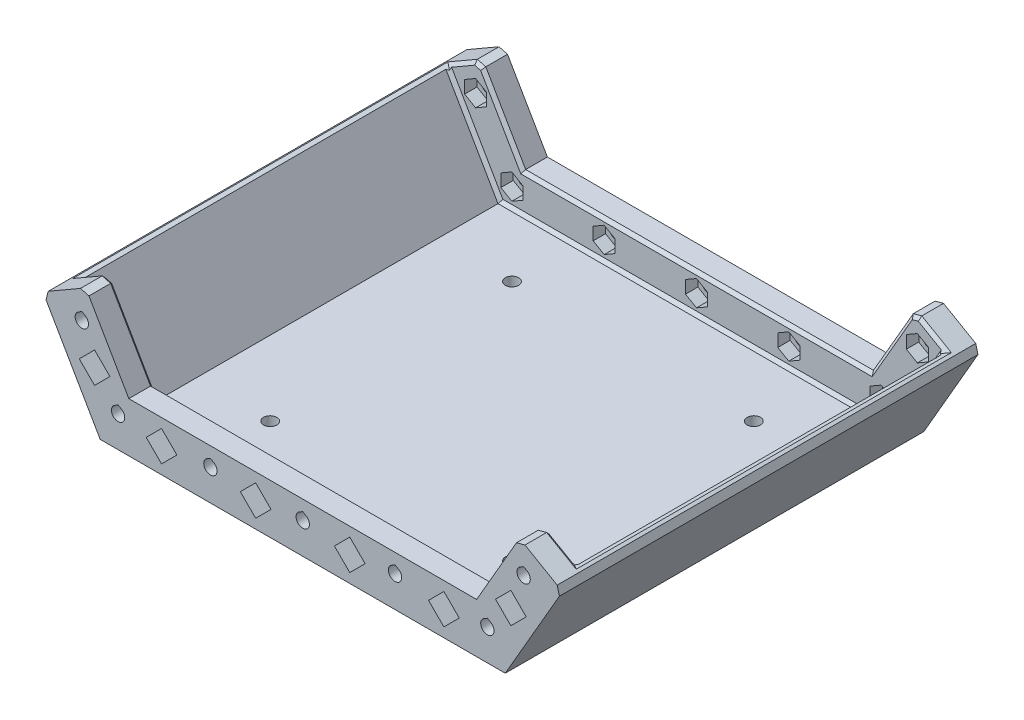
from build123d import *

# Parameters (mm, degrees)
BOSS_EXTRUDE1_DEPTH = 59.5
BOSS_EXTRUDE2_DEPTH = 8
SKETCH3_R           = 2.15
CUT_EXTRUDE1_DEPTH  = 159.997122203
CUT_EXTRUDE2_DEPTH  = 4
CUT_EXTRUDE3_DEPTH  = 5
CHAMFER1_SIZE       = 2
CHAMFER2_SIZE       = 1
SKETCH7_R           = 2.15
CUT_EXTRUDE4_DEPTH  = 113.417646184
CHAMFER3_SIZE       = 1
CUT_EXTRUDE6_DEPTH  = 171.814159757
CUT_EXTRUDE7_DEPTH  = 171.814159757


with BuildPart() as part:
    # Sketch1 → Boss-Extrude1 (new, symmetric)
    with BuildSketch(Plane.XY):
        Polygon((-83.803847577, -32), (-65.328638963, -64), (65.328638963, -64), (83.803847577, -32), (80.339745962, -30), (63.019237886, -60), (-63.019237886, -60), (-80.339745962, -30), align=None)
    extrude(amount=BOSS_EXTRUDE1_DEPTH, both=True)

    # Sketch2 → Boss-Extrude2 (add)
    with BuildSketch(Plane.XY.offset(59.5)):
        Polygon((-83.803847577, -32), (-69.947441117, -24), (-56.091034656, -48), (56.091034656, -48), (69.947441117, -24), (83.803847577, -32), (65.328638963, -64), (-65.328638963, -64), align=None)
    boss_extrude2 = extrude(amount=BOSS_EXTRUDE2_DEPTH)

    # Sketch3 → Cut-Extrude1 (cut, through all)
    with BuildSketch(Plane(origin=(0, 0, 59.5), x_dir=(-1, 0, 0), z_dir=(0, 0, -1))):
        with Locations((-71.246479222, -33.75)):
            Circle(SKETCH3_R)
        with Locations((-59.555136271, -54)):
            Circle(SKETCH3_R)
        with Locations((-29.777568136, -54)):
            Circle(SKETCH3_R)
        with Locations((0, -54)):
            Circle(SKETCH3_R)
        with Locations((29.777568136, -54)):
            Circle(SKETCH3_R)
        with Locations((59.555136271, -54)):
            Circle(SKETCH3_R)
        with Locations((71.246479222, -33.75)):
            Circle(SKETCH3_R)
    cut_extrude1 = extrude(amount=-CUT_EXTRUDE1_DEPTH, mode=Mode.SUBTRACT)

    # Sketch4 → Cut-Extrude2 (cut)
    with BuildSketch(Plane(origin=(0, 0, 59.5), x_dir=(-1, 0, 0), z_dir=(0, 0, -1))):
        Polygon((-67.696479222, -35.799593456), (-67.696479222, -31.700406544), (-71.246479222, -29.650813089), (-74.796479222, -31.700406544), (-74.796479222, -35.799593456), (-71.246479222, -37.849186911), align=None)
        Polygon((-56.005136271, -51.950406544), (-59.555136271, -49.900813089), (-63.105136271, -51.950406544), (-63.105136271, -56.049593456), (-59.555136271, -58.099186911), (-56.005136271, -56.049593456), align=None)
        Polygon((-3.55, -56.049593456), (0, -58.099186911), (3.55, -56.049593456), (3.55, -51.950406544), (0, -49.900813089), (-3.55, -51.950406544), align=None)
        Polygon((56.005136271, -56.049593456), (59.555136271, -58.099186911), (63.105136271, -56.049593456), (63.105136271, -51.950406544), (59.555136271, -49.900813089), (56.005136271, -51.950406544), align=None)
        Polygon((67.696479222, -31.700406544), (67.696479222, -35.799593456), (71.246479222, -37.849186911), (74.796479222, -35.799593456), (74.796479222, -31.700406544), (71.246479222, -29.650813089), align=None)
        Polygon((-26.227568136, -51.950406544), (-29.777568136, -49.900813089), (-33.327568136, -51.950406544), (-33.327568136, -56.049593456), (-29.777568136, -58.099186911), (-26.227568136, -56.049593456), align=None)
        Polygon((33.327568136, -51.950406544), (29.777568136, -49.900813089), (26.227568136, -51.950406544), (26.227568136, -56.049593456), (29.777568136, -58.099186911), (33.327568136, -56.049593456), align=None)
    cut_extrude2 = extrude(amount=-CUT_EXTRUDE2_DEPTH, mode=Mode.SUBTRACT)

    # Sketch6 → Cut-Extrude3 (cut)
    with BuildSketch(Plane.XY.offset(67.5)):
        Polygon((-67.132858554, -49.824747468), (-72.082606023, -44.875), (-67.132858554, -39.925252532), (-62.183111086, -44.875), align=None)
        Polygon((62.183111086, -44.875), (67.132858554, -39.925252532), (72.082606023, -44.875), (67.132858554, -49.824747468), align=None)
        Polygon((50.482125076, -56), (45.532377607, -51.050252532), (40.582630139, -56), (45.532377607, -60.949747468), align=None)
        Polygon((-40.582630139, -56), (-45.532377607, -51.050252532), (-50.482125076, -56), (-45.532377607, -60.949747468), align=None)
        Polygon((-10.227711734, -56), (-15.177459202, -51.050252532), (-20.127206671, -56), (-15.177459202, -60.949747468), align=None)
        Polygon((20.127206671, -56), (15.177459202, -51.050252532), (10.227711734, -56), (15.177459202, -60.949747468), align=None)
    cut_extrude3 = extrude(amount=-CUT_EXTRUDE3_DEPTH, mode=Mode.SUBTRACT)

    # Mirror1: Boss-Extrude2, Cut-Extrude1, Cut-Extrude2, Cut-Extrude3 across plane
    add(boss_extrude2.mirror(Plane.XY))
    add(cut_extrude1.mirror(Plane.XY), mode=Mode.SUBTRACT)
    add(cut_extrude2.mirror(Plane.XY), mode=Mode.SUBTRACT)
    add(cut_extrude3.mirror(Plane.XY), mode=Mode.SUBTRACT)

    # Chamfer1
    chamfer1_edges = [part.edges().sort_by_distance(p)[0] for p in [
        (83.803847577, -32, 0),
        (-83.803847577, -32, 0),
        (69.947441117, -24, 63.5),
        (-69.947441117, -24, 63.5),
        (-69.947441117, -24, -63.5),
        (69.947441117, -24, -63.5),
    ]]
    chamfer(chamfer1_edges, length=CHAMFER1_SIZE)

    # Chamfer2
    chamfer2_edges = [part.edges().sort_by_distance(p)[0] for p in [
        (-80.339745962, -30, 0),
        (80.339745962, -30, 0),
        (76.009618943, -27.5, 59.5),
        (0, -48, 59.5),
        (-62.519237886, -36.866025404, 59.5),
        (76.009618943, -27.5, -59.5),
        (0, -48, -59.5),
        (-62.519237886, -36.866025404, -59.5),
        (62.519237886, -36.866025404, -59.5),
        (-76.009618943, -27.5, -59.5),
        (70.313466521, -25.366025404, -59.5),
        (-70.313466521, -25.366025404, -59.5),
        (-76.009618943, -27.5, 59.5),
        (62.519237886, -36.866025404, 59.5),
        (70.313466521, -25.366025404, 59.5),
        (-70.313466521, -25.366025404, 59.5),
    ]]
    chamfer(chamfer2_edges, length=CHAMFER2_SIZE)

    # Sketch7 → Cut-Extrude4 (cut, through all)
    with BuildSketch(Plane(origin=(0, -60, 0), x_dir=(1, 0, 0), z_dir=(0, 1, 0))):
        with Locations(Location((-39, 39, 0), (0, 0, 180))):
            Circle(SKETCH7_R)
        with Locations(Location((39, 39, 0), (0, 0, 180))):
            Circle(SKETCH7_R)
        with Locations(Location((39, -39, 0), (0, 0, 180))):
            Circle(SKETCH7_R)
        with Locations(Location((-39, -39, 0), (0, 0, 180))):
            Circle(SKETCH7_R)
    extrude(amount=-CUT_EXTRUDE4_DEPTH, mode=Mode.SUBTRACT)

    # Chamfer3
    chamfer3_edges = [part.edges().sort_by_distance(p)[0] for p in [
        (0, -60, 59.5),
        (-71.429491924, -45.433012702, 59.5),
        (71.429491924, -45.433012702, 59.5),
        (71.429491924, -45.433012702, -59.5),
        (-71.429491924, -45.433012702, -59.5),
        (0, -60, -59.5),
    ]]
    chamfer(chamfer3_edges, length=CHAMFER3_SIZE)

    # Sketch9 → Cut-Extrude6 (cut, through all)
    with BuildSketch(Plane(origin=(0, 0, -67.5), x_dir=(-1, 0, 0), z_dir=(0, 0, -1))):
        Polygon((-72.321479222, -31.888045382), (-71.246479222, -31.267393842), (-70.171479222, -31.888045382), align=None)
        Polygon((-60.630136271, -52.138045382), (-58.480136271, -52.138045382), (-59.555136271, -51.517393842), align=None)
        Polygon((-28.702568136, -52.138045382), (-30.852568136, -52.138045382), (-29.777568136, -51.517393842), align=None)
    cut_extrude6 = extrude(amount=-CUT_EXTRUDE6_DEPTH, mode=Mode.SUBTRACT)

    # Mirror2: Cut-Extrude6 across plane
    add(cut_extrude6.mirror(Plane(origin=(0, 0, 0), x_dir=(0, 0, 1), z_dir=(1, 0, 0))), mode=Mode.SUBTRACT)

    # Sketch10 → Cut-Extrude7 (cut, through all)
    with BuildSketch(Plane(origin=(0, 0, -67.5), x_dir=(-1, 0, 0), z_dir=(0, 0, -1))):
        Polygon((-1.075, -52.138045382), (1.075, -52.138045382), (0, -51.517393842), align=None)
    extrude(amount=-CUT_EXTRUDE7_DEPTH, mode=Mode.SUBTRACT)


solid = part.part
